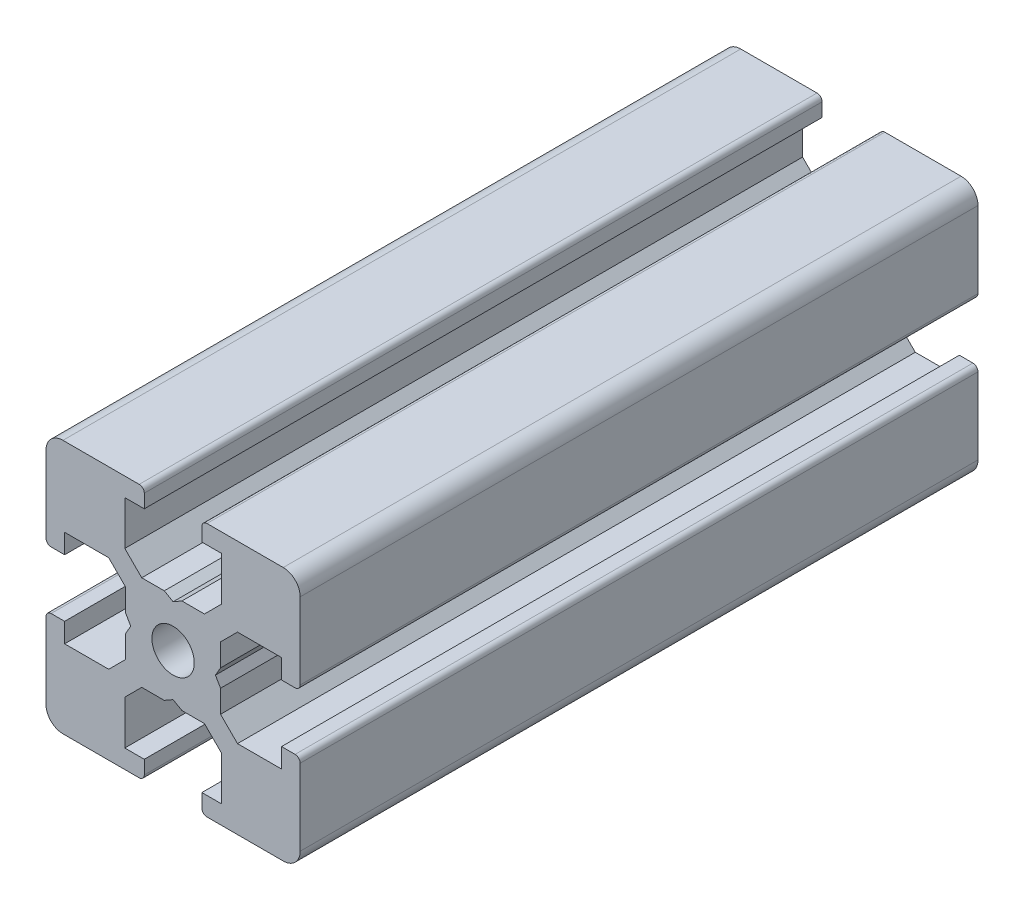
from build123d import *

# Parameters (mm, degrees)
SKETCH1_R           = 1.25
BOSS_EXTRUDE1_DEPTH = 40


with BuildPart() as part:
    # Sketch1 → Boss-Extrude1 (new body)
    with BuildSketch(Plane.XY.offset(115)):
        with BuildLine():
            Line((-7.5, 6.5), (-7.5, 2))
            ThreePointArc((-7.5, 2), (-7.412132034, 1.787867966), (-7.2, 1.7))
            Line((-7.2, 1.7), (-6.4, 1.7))
            Line((-6.4, 1.7), (-6.4, 2.85))
            Line((-6.4, 2.85), (-3.8, 2.85))
            Line((-3.8, 2.85), (-2.8, 1.85))
            Line((-2.8, 1.85), (-2.8, 0.519615242))
            Line((-2.8, 0.519615242), (-2.5, 0))
            Line((-2.5, 0), (-2.8, -0.519615242))
            Line((-2.8, -0.519615242), (-2.8, -1.85))
            Line((-2.8, -1.85), (-3.8, -2.85))
            Line((-3.8, -2.85), (-6.4, -2.85))
            Line((-6.4, -2.85), (-6.4, -1.7))
            Line((-6.4, -1.7), (-7.2, -1.7))
            ThreePointArc((-7.2, -1.7), (-7.412132034, -1.787867966), (-7.5, -2))
            Line((-7.5, -2), (-7.5, -6.5))
            ThreePointArc((-7.5, -6.5), (-7.207106781, -7.207106781), (-6.5, -7.5))
            Line((-6.5, -7.5), (-2, -7.5))
            ThreePointArc((-2, -7.5), (-1.787867966, -7.412132034), (-1.7, -7.2))
            Line((-1.7, -7.2), (-1.7, -6.4))
            Line((-1.7, -6.4), (-2.85, -6.4))
            Line((-2.85, -6.4), (-2.85, -3.8))
            Line((-2.85, -3.8), (-1.85, -2.8))
            Line((-1.85, -2.8), (-0.519615242, -2.8))
            Line((-0.519615242, -2.8), (0, -2.5))
            Line((0, -2.5), (0.519615242, -2.8))
            Line((0.519615242, -2.8), (1.85, -2.8))
            Line((1.85, -2.8), (2.85, -3.8))
            Line((2.85, -3.8), (2.85, -6.4))
            Line((2.85, -6.4), (1.7, -6.4))
            Line((1.7, -6.4), (1.7, -7.2))
            ThreePointArc((1.7, -7.2), (1.787867966, -7.412132034), (2, -7.5))
            Line((2, -7.5), (6.5, -7.5))
            ThreePointArc((6.5, -7.5), (7.207106781, -7.207106781), (7.5, -6.5))
            Line((7.5, -6.5), (7.5, -2))
            ThreePointArc((7.5, -2), (7.412132034, -1.787867966), (7.2, -1.7))
            Line((7.2, -1.7), (6.4, -1.7))
            Line((6.4, -1.7), (6.4, -2.85))
            Line((6.4, -2.85), (3.8, -2.85))
            Line((3.8, -2.85), (2.8, -1.85))
            Line((2.8, -1.85), (2.8, -0.519615242))
            Line((2.8, -0.519615242), (2.5, 0))
            Line((2.5, 0), (2.8, 0.519615242))
            Line((2.8, 0.519615242), (2.8, 1.85))
            Line((2.8, 1.85), (3.8, 2.85))
            Line((3.8, 2.85), (6.4, 2.85))
            Line((6.4, 2.85), (6.4, 1.7))
            Line((6.4, 1.7), (7.2, 1.7))
            ThreePointArc((7.2, 1.7), (7.412132034, 1.787867966), (7.5, 2))
            Line((7.5, 2), (7.5, 6.5))
            ThreePointArc((7.5, 6.5), (7.207106781, 7.207106781), (6.5, 7.5))
            Line((6.5, 7.5), (2, 7.5))
            ThreePointArc((2, 7.5), (1.787867966, 7.412132034), (1.7, 7.2))
            Line((1.7, 7.2), (1.7, 6.4))
            Line((1.7, 6.4), (2.85, 6.4))
            Line((2.85, 6.4), (2.85, 3.8))
            Line((2.85, 3.8), (1.85, 2.8))
            Line((1.85, 2.8), (0.519615242, 2.8))
            Line((0.519615242, 2.8), (0, 2.5))
            Line((0, 2.5), (-0.519615242, 2.8))
            Line((-0.519615242, 2.8), (-1.85, 2.8))
            Line((-1.85, 2.8), (-2.85, 3.8))
            Line((-2.85, 3.8), (-2.85, 6.4))
            Line((-2.85, 6.4), (-1.7, 6.4))
            Line((-1.7, 6.4), (-1.7, 7.2))
            ThreePointArc((-1.7, 7.2), (-1.787867966, 7.412132034), (-2, 7.5))
            Line((-2, 7.5), (-6.5, 7.5))
            ThreePointArc((-6.5, 7.5), (-7.207106781, 7.207106781), (-7.5, 6.5))
        make_face()
        with Locations(Location((0, 0, 0), (0, 0, 180))):
            Circle(SKETCH1_R, mode=Mode.SUBTRACT)
    extrude(amount=-BOSS_EXTRUDE1_DEPTH)


solid = part.part
